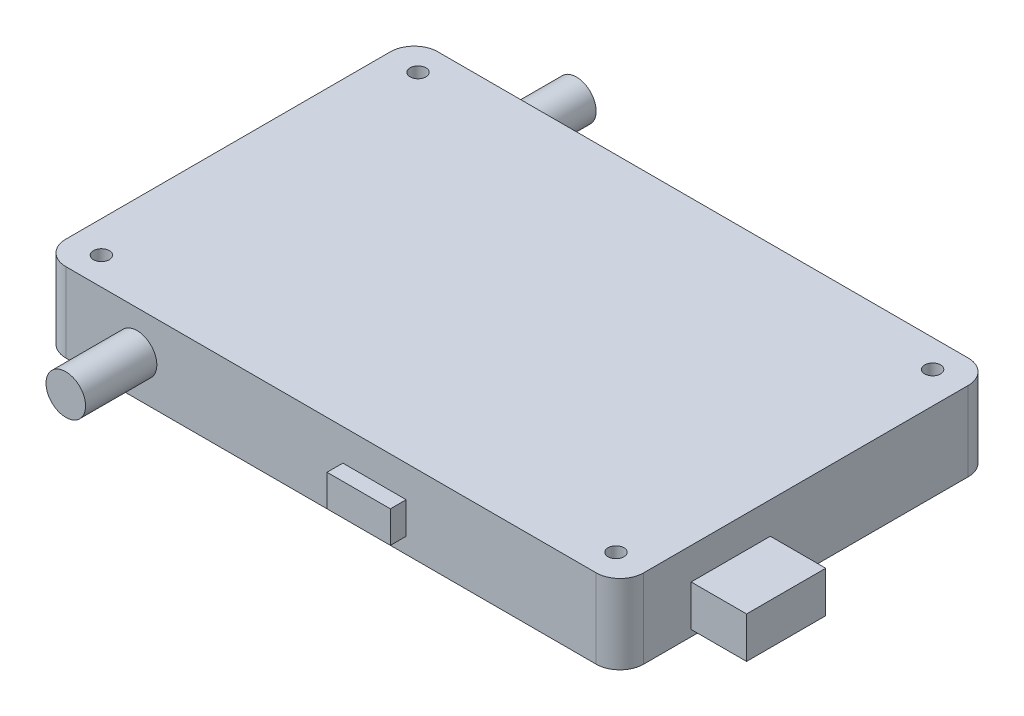
from build123d import *

# Parameters (mm, degrees)
SKETCH_1_W          = 73
SKETCH_1_H          = 47
SKETCH_1_R          = 1
EXTRUDE_1_DEPTH     = 10
FILLET_1_R          = 3
SKETCH_3_R          = 2
CUT_EXTRUDE_1_DEPTH = 1
SKETCH_2_R          = 2.5
EXTRUDE_2_DEPTH     = 8.5
EXTRUDE_START       = 9
SKETCH_5_R          = 2.5
EXTRUDE_3_DEPTH     = 9
SKETCH_6_W          = 8
SKETCH_6_H          = 4
LAN_DEPTH           = 2
SKETCH_7_W          = 11
SKETCH_7_H          = 4
COM_DEPTH           = 2
SKETCH_8_W          = 10
SKETCH_8_H          = 5.2
XT30_DEPTH          = 7


with BuildPart() as part:
    # 草图1 → 凸台-拉伸1 (new body)
    with BuildSketch(Plane(origin=(0, 0, 0), x_dir=(1, 0, 0), z_dir=(0, 1, 0))):
        with Locations((36.5, 23.5)):
            Rectangle(SKETCH_1_W, SKETCH_1_H)
        with Locations(Location((4, 3.5, 0), (0, 0, 270))):
            Circle(SKETCH_1_R, mode=Mode.SUBTRACT)
        with Locations(Location((4, 43.5, 0), (0, 0, 90))):
            Circle(SKETCH_1_R, mode=Mode.SUBTRACT)
        with Locations(Location((69, 3.5, 0), (0, 0, 90))):
            Circle(SKETCH_1_R, mode=Mode.SUBTRACT)
        with Locations(Location((69, 43.5, 0), (0, 0, 270))):
            Circle(SKETCH_1_R, mode=Mode.SUBTRACT)
    extrude(amount=EXTRUDE_1_DEPTH)

    # 圆角1
    fillet_1_edges = [part.edges().sort_by_distance(p)[0] for p in [
        (0, 5, -47),
        (73, 5, -47),
        (73, 5, 0),
        (0, 5, 0),
    ]]
    fillet(fillet_1_edges, radius=FILLET_1_R)

    # 草图3 → 切除-拉伸1 (cut)
    with BuildSketch(Plane.XZ):
        with Locations(Location((4, -43.5, 0), (0, 0, 270))):
            Circle(SKETCH_3_R)
        with Locations(Location((4, -3.5, 0), (0, 0, 270))):
            Circle(SKETCH_3_R)
        with Locations(Location((69, -3.5, 0), (0, 0, 270))):
            Circle(SKETCH_3_R)
        with Locations(Location((69, -43.5, 0), (0, 0, 270))):
            Circle(SKETCH_3_R)
    extrude(amount=-CUT_EXTRUDE_1_DEPTH, mode=Mode.SUBTRACT)

    # 草图2 → 凸台-拉伸2 (add)
    with BuildSketch(Plane(origin=(0, 0, -47), x_dir=(-1, 0, 0), z_dir=(0, 0, -1))):
        with Locations(Location((-12, 5, 0), (0, 0, 180))):
            Circle(SKETCH_2_R)
    extrude(amount=EXTRUDE_2_DEPTH)

    # 草图5 → 凸台-拉伸3 (add)
    with BuildSketch(Plane.XY.offset(EXTRUDE_START)):
        with Locations((12, 5)):
            Circle(SKETCH_5_R)
    extrude(amount=-EXTRUDE_3_DEPTH)

    # 草图6 → LAN口预留 (add)
    with BuildSketch(Plane.XY):
        with Locations((42, 4)):
            Rectangle(SKETCH_6_W, SKETCH_6_H)
    extrude(amount=LAN_DEPTH)

    # 草图7 → COM口预留 (add)
    with BuildSketch(Plane(origin=(0, 0, -47), x_dir=(-1, 0, 0), z_dir=(0, 0, -1))):
        with Locations((-53.5, 4)):
            Rectangle(SKETCH_7_W, SKETCH_7_H)
    extrude(amount=COM_DEPTH)

    # 草图8 → XT30预留 (add)
    with BuildSketch(Plane(origin=(73, 0, 0), x_dir=(0, 0, -1), z_dir=(1, 0, 0))):
        with Locations((14, 3.4)):
            Rectangle(SKETCH_8_W, SKETCH_8_H)
    extrude(amount=XT30_DEPTH)


solid = part.part
